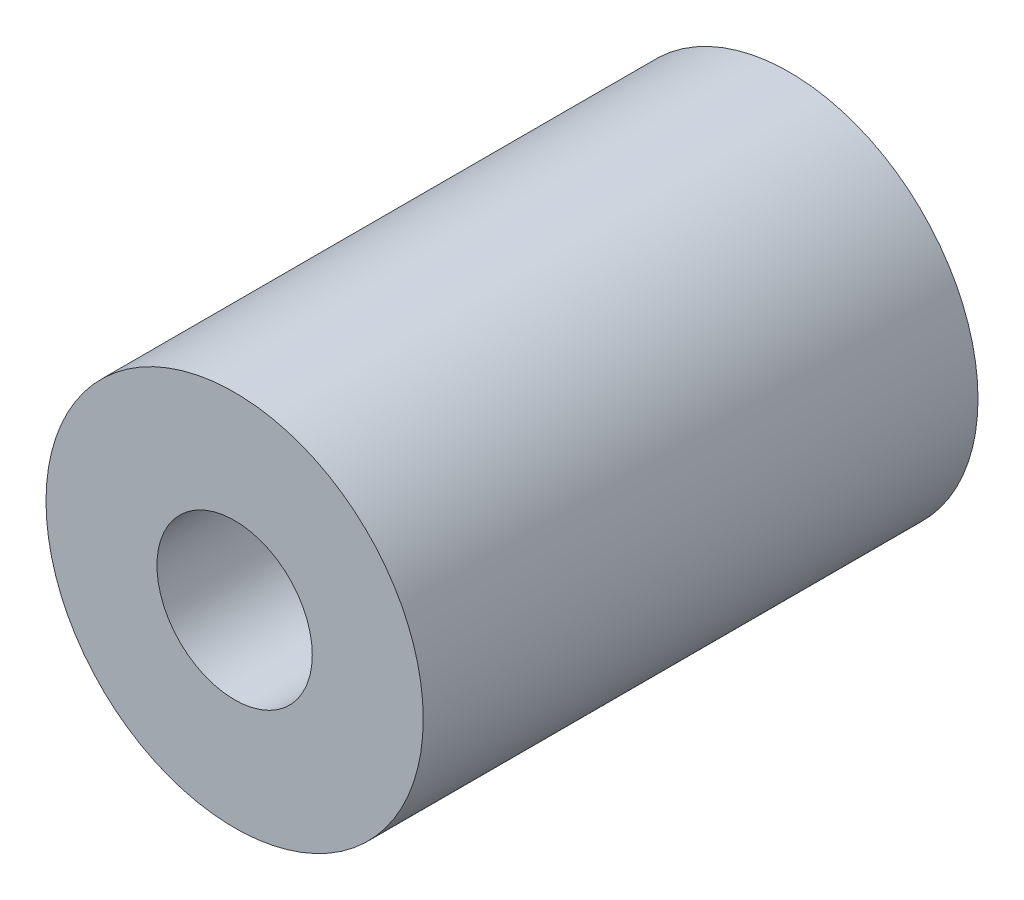
from build123d import *

# Parameters (mm, degrees)
SKETCH1_R      = 3.4
SKETCH1_R_2    = 1.4
EXTRUDE1_DEPTH = 5


with BuildPart() as part:
    # Sketch1 → Extrude1 (new, symmetric)
    with BuildSketch(Plane.XY):
        Circle(SKETCH1_R)
        Circle(SKETCH1_R_2, mode=Mode.SUBTRACT)
    extrude(amount=EXTRUDE1_DEPTH, both=True)


solid = part.part
